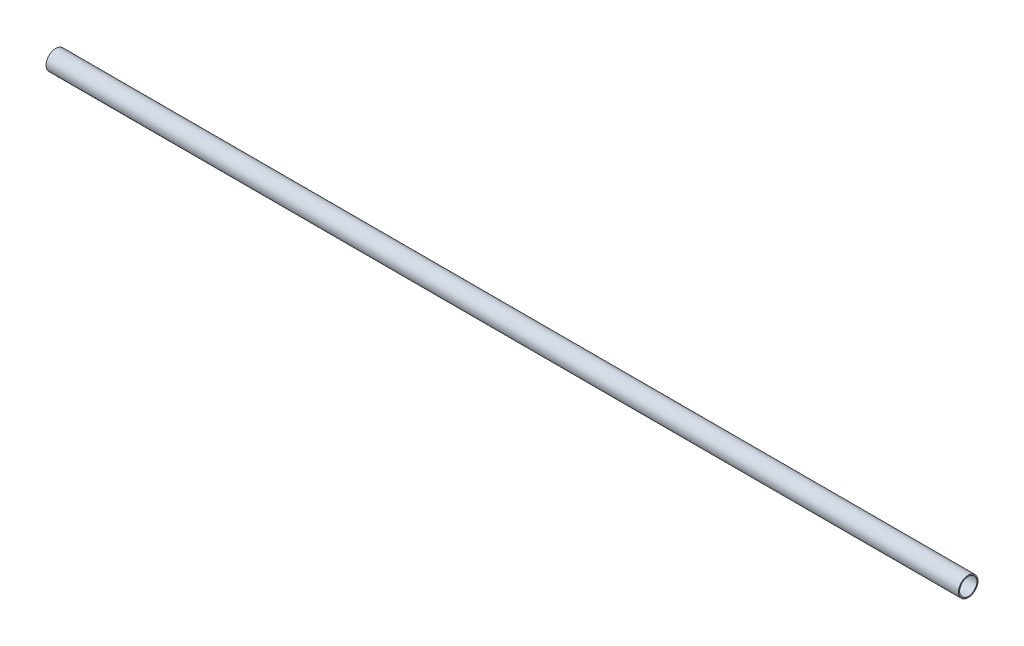
from build123d import *

# Parameters (mm, degrees)
SKETCH1_R           = 1.5748
SKETCH1_R_2         = 1.397
BOSS_EXTRUDE1_DEPTH = 147.32


with BuildPart() as part:
    # Sketch1 → Boss-Extrude1 (new body)
    with BuildSketch(Plane(origin=(0, 0, 0), x_dir=(0, 0, -1), z_dir=(1, 0, 0))):
        Circle(SKETCH1_R)
        Circle(SKETCH1_R_2, mode=Mode.SUBTRACT)
    extrude(amount=BOSS_EXTRUDE1_DEPTH)


solid = part.part
